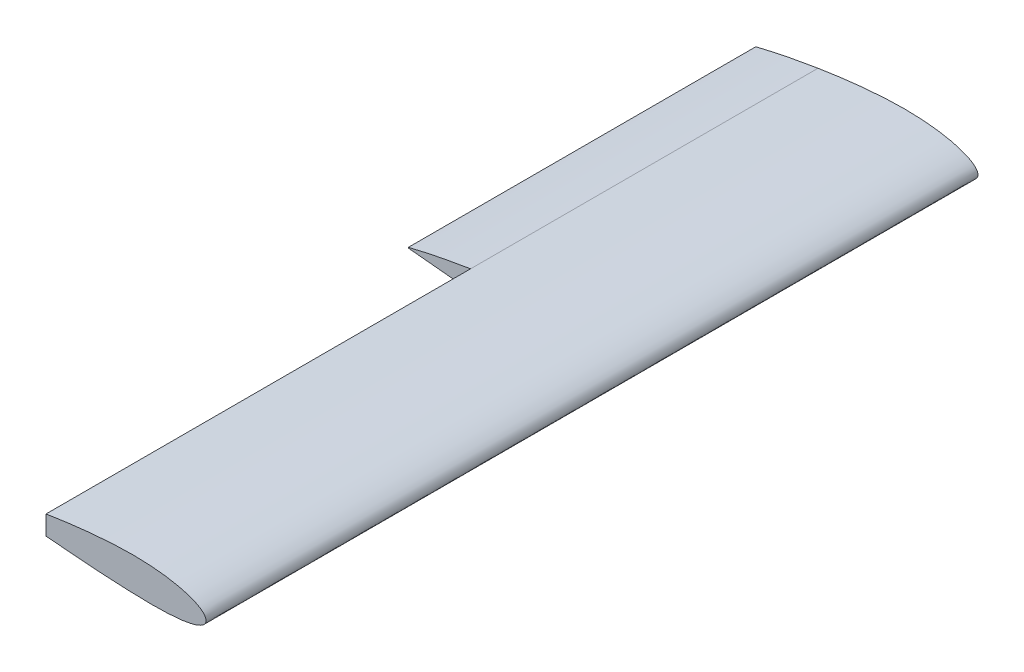
from build123d import *

# Parameters (mm, degrees)
BOSS_EXTRUDE1_DEPTH = 1120
BOSS_EXTRUDE2_DEPTH = 504
SKETCH3_R           = 13
CUT_EXTRUDE1_DEPTH  = 801
SKETCH4_W           = 32
SKETCH4_H           = 40.882
CUT_EXTRUDE2_DEPTH  = 46
SKETCH5_W           = 60
SKETCH5_H           = 12
CUT_EXTRUDE3_DEPTH  = 46
SKETCH6_W           = 54
SKETCH6_H           = 29.1
CUT_EXTRUDE4_DEPTH  = 64
SKETCH7_W           = 20.4
SKETCH7_H           = 6.8
CUT_EXTRUDE5_DEPTH  = 26


with BuildPart() as part:
    # Sketch1 → Boss-Extrude1 (new body)
    with BuildSketch(Plane.XY):
        with BuildLine():
            Line((-232.07976, 18.640331755), (-232.07976, -9.299539429))
            add(Edge.make_bspline(
                [(-232.07976, 18.640331755), (-229.164273263, 19.105137392), (-222.291133752, 20.200897474), (-211.337542784, 21.800276655), (-199.146674743, 23.458907068), (-186.709533826, 24.99775787), (-174.104063941, 26.396384265), (-161.408619673, 27.628181699), (-148.702826871, 28.669998803), (-136.048616227, 29.498668375), (-123.502304929, 30.100378699), (-111.141296499, 30.381034684), (-99.066442851, 30.337763188), (-87.381824011, 29.96392256), (-76.165988678, 29.262541202), (-65.494170353, 28.242118376), (-55.437562328, 26.917551706), (-46.062520993, 25.309550624), (-37.429846456, 23.444065126), (-29.594109363, 21.3513396), (-22.603015821, 19.064676337), (-16.496733591, 16.618893003), (-11.307130205, 14.048195179), (-7.056738632, 11.383320116), (-3.758682454, 8.645345207), (-1.421067217, 5.837729222), (-0.076519927, 2.93397469), (0.175352503, -0.017611891), (-0.655158047, -2.858555013), (-2.530689177, -5.439611815), (-5.336827593, -7.743904666), (-9.03994776, -9.814562437), (-13.624875961, -11.664753347), (-19.070291538, -13.294987869), (-25.346462309, -14.70103051), (-32.416774291, -15.879078453), (-40.239338685, -16.827563542), (-48.768060709, -17.548259209), (-57.953346605, -18.046825288), (-67.742561923, -18.333070043), (-78.080327008, -18.420905027), (-88.908707336, -18.328114372), (-100.167316867, -18.075575791), (-111.793460515, -17.687481617), (-123.745328455, -17.185705506), (-135.973510615, -16.604056476), (-148.402819763, -15.890368868), (-160.93563744, -15.074548453), (-173.478390843, -14.17792148), (-185.955186825, -13.221857076), (-198.290086365, -12.225761595), (-210.407470499, -11.20618891), (-221.646872664, -10.232436467), (-228.837861155, -9.589426373), (-232.07976, -9.299539429)],
                knots=[0, 0, 0, 0, 0.018424224, 0.043434346, 0.069080412, 0.095203092, 0.121640117, 0.148227444, 0.17480049, 0.201195447, 0.227363977, 0.253181792, 0.278347264, 0.302710399, 0.326128333, 0.348466602, 0.369600377, 0.389415723, 0.407811011, 0.424698681, 0.44000774, 0.453687637, 0.465714725, 0.476103672, 0.484928355, 0.492360154, 0.498730164, 0.504586951, 0.510443348, 0.516803825, 0.524198712, 0.532940661, 0.543185695, 0.554995644, 0.568376342, 0.583298542, 0.599709376, 0.617538825, 0.636703502, 0.65710892, 0.678650912, 0.701216586, 0.724685048, 0.748928058, 0.7738107, 0.799337901, 0.825325561, 0.851504471, 0.877716004, 0.903800001, 0.929595993, 0.954944401, 0.979687675, 1, 1, 1, 1], degree=3))
        make_face()
    extrude(amount=BOSS_EXTRUDE1_DEPTH)

    # Sketch2 → Boss-Extrude2 (add)
    with BuildSketch(Plane.XY):
        with BuildLine():
            Line((-232.07976, 18.640331755), (-232.07976, -9.299539429))
            add(Edge.make_bspline(
                [(-232.07976, -9.299539429), (-232.665749528, -9.247457079), (-236.934557579, -8.868048329), (-244.715948926, -8.155780655), (-255.233547628, -7.182675415), (-265.178963193, -6.244796096), (-274.489444659, -5.35296602), (-283.105666868, -4.514522896), (-290.972478934, -3.737169374), (-298.039247191, -3.028597089), (-304.260184667, -2.39533485), (-309.594932862, -1.846814612), (-314.008232694, -1.38276071), (-317.472079994, -1.027677658), (-319.961203892, -0.741044399), (-321.464120443, -0.620061141), (-322.14198951, -0.505870173), (-322.321741193, -0.506509982), (-322.333, -0.506550056)],
                knots=[0, 0, 0, 0, 0.019462551, 0.14178051, 0.258505433, 0.368899529, 0.472261554, 0.567931303, 0.655293986, 0.733784513, 0.802891701, 0.862162346, 0.911205133, 0.949694244, 0.977372582, 0.994054454, 0.999627599, 1, 1, 1, 1], degree=3))
            Line((-322.333, -0.506550056), (-322.333, 0.514797488))
            add(Edge.make_bspline(
                [(-232.07976, 18.640331755), (-232.997104276, 18.496640375), (-237.59945591, 17.775735177), (-245.697898879, 16.398726282), (-256.18174484, 14.549633525), (-266.070518156, 12.708392515), (-275.306517101, 10.911856103), (-283.834257123, 9.183893288), (-291.603294753, 7.551136168), (-298.567863892, 6.038773121), (-304.687234469, 4.671058189), (-309.925850109, 3.470601356), (-314.253461721, 2.457844833), (-317.645235976, 1.650544318), (-320.081782459, 1.063070488), (-321.538022536, 0.709024901), (-322.180548986, 0.552044036), (-322.333, 0.514797488)],
                knots=[0, 0, 0, 0, 0.030251696, 0.151773928, 0.267626296, 0.377089872, 0.479484952, 0.574174897, 0.660569789, 0.738129949, 0.806369318, 0.864858701, 0.913228834, 0.951173208, 0.978450569, 0.994887008, 1, 1, 1, 1], degree=3))
        make_face()
    extrude(amount=BOSS_EXTRUDE2_DEPTH)

    # Sketch3 → Cut-Extrude1 (cut)
    with BuildSketch(Plane.XY):
        with Locations((-96.7, 6.044)):
            Circle(SKETCH3_R)
    extrude(amount=CUT_EXTRUDE1_DEPTH, mode=Mode.SUBTRACT)

    # Sketch4 → Cut-Extrude2 (cut)
    with BuildSketch(Plane.XY.offset(330.7)):
        with Locations((-96.7, 1.303)):
            Rectangle(SKETCH4_W, SKETCH4_H)
    extrude(amount=CUT_EXTRUDE2_DEPTH, mode=Mode.SUBTRACT)

    # Sketch5 → Cut-Extrude3 (cut)
    with BuildSketch(Plane.XY.offset(330.7)):
        with Locations((-257.8664, -2.987)):
            Rectangle(SKETCH5_W, SKETCH5_H)
    extrude(amount=CUT_EXTRUDE3_DEPTH, mode=Mode.SUBTRACT)

    # Sketch6 → Cut-Extrude4 (cut)
    with BuildSketch(Plane.XY.offset(534.5)):
        with Locations((-177.283, -2.36)):
            Rectangle(SKETCH6_W, SKETCH6_H)
    extrude(amount=CUT_EXTRUDE4_DEPTH, mode=Mode.SUBTRACT)

    # Sketch7 → Cut-Extrude5 (cut)
    with BuildSketch(Plane.XY.offset(-0.5)):
        with Locations((-225.633, 4.835)):
            Rectangle(SKETCH7_W, SKETCH7_H)
    extrude(amount=CUT_EXTRUDE5_DEPTH, mode=Mode.SUBTRACT)


solid = part.part
